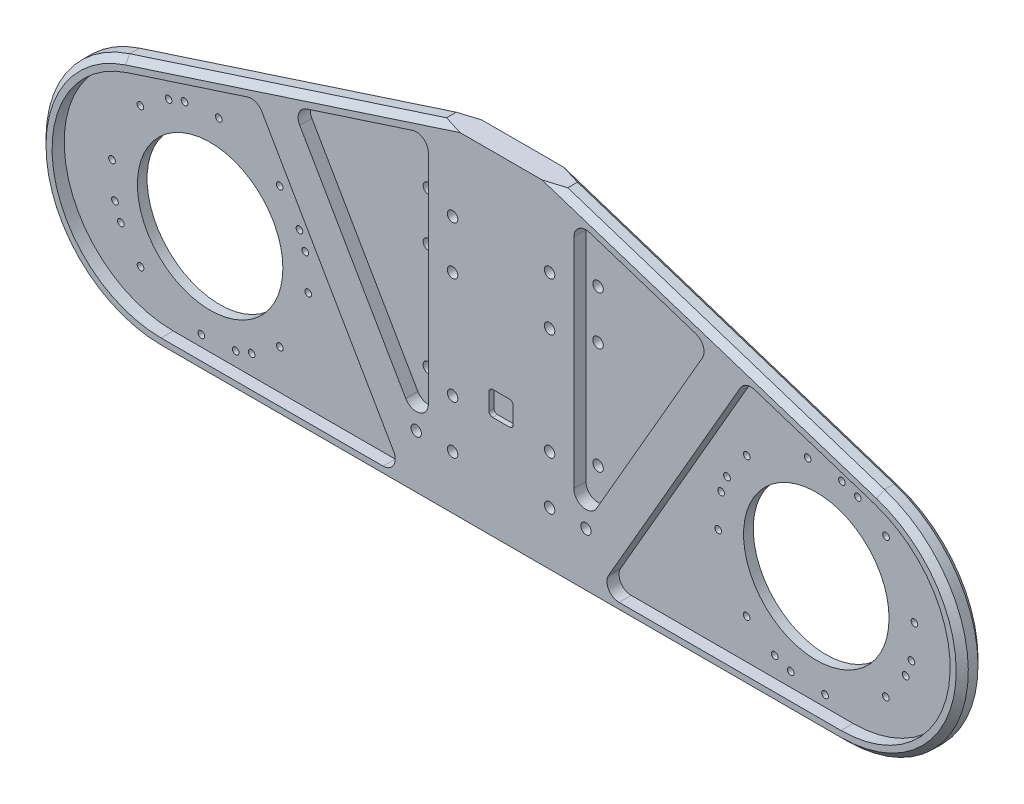
from build123d import *

# Parameters (mm, degrees)
SKETCH_1_R               = 60
EXTRUDE_1_DEPTH          = 8
FILLET_1_R               = 100
EXTRUDE_START            = 10
EXTRUDE_2_DEPTH          = 10
FILLET_2_R               = 10
CHAMFER_1_SIZE           = 5
CUT_EXTRUDE_1_DEPTH      = 514.758413114
CUT_EXTRUDE_1_DEPTH_BACK = 514.758413114
SKETCH_3_R               = 4.3
SKETCH_4_R               = 2.75
CUT_EXTRUDE_2_DEPTH      = 10
SKETCH_5_R               = 6
CUT_EXTRUDE_3_DEPTH      = 4
SKETCH_6_W               = 20
SKETCH_6_H               = 20
CUT_EXTRUDE_4_DEPTH      = 4
FILLET_3_R               = 3


with BuildPart() as part:
    # 草图1 → 凸台-拉伸1 (new body)
    with BuildSketch(Plane.XY):
        Polygon((0, 0), (-100, 0), (-961.751390409, 0), (-100, 280), (0, 280), (861.751390409, 0), align=None)
        with Locations((200, 100)):
            Circle(SKETCH_1_R, mode=Mode.SUBTRACT)
        with Locations((-300, 100)):
            Circle(SKETCH_1_R, mode=Mode.SUBTRACT)
    extrude(amount=EXTRUDE_1_DEPTH)

    # 圆角1
    fillet_1_edges = [part.edges().sort_by_distance(p)[0] for p in [
        (-961.751390409, 0, 4),
        (861.751390409, 0, 4),
    ]]
    fillet(fillet_1_edges, radius=FILLET_1_R)

    # 草图2 → 凸台-拉伸2 (add)
    # profile 1 of 2: a face of its own
    with BuildSketch(Plane.XY.offset(8).offset(EXTRUDE_START)):
        with BuildLine():
            Line((-50, 0), (-50, 280))
            Line((-50, 280), (-100, 280))
            Line((-100, 280), (-361.277938379, 195.10565163))
            ThreePointArc((-361.277938379, 195.10565163), (-429.145073001, 84.356553496), (-330.376238942, 0))
            Line((-330.376238942, 0), (-50, 0))
        make_face()
        with BuildLine():
            Line((-358.187768435, 185.595086467), (-251.410485182, 220.289128906))
            Line((-251.410485182, 220.289128906), (-130, 10))
            Line((-130, 10), (-330.376238942, 10))
            ThreePointArc((-330.376238942, 10), (-419.268189595, 85.920898146), (-358.187768435, 185.595086467))
        make_face(mode=Mode.SUBTRACT)
        Polygon((-110, 266.236180795), (-110, 35.358983849), (-222.241374643, 229.766747442), align=None, mode=Mode.SUBTRACT)
    # profile 2 of 2: a face of its own
    with BuildSketch(Plane.XY.offset(8).offset(EXTRUDE_START)):
        with BuildLine():
            Line((261.277938379, 195.10565163), (0, 280))
            Line((0, 280), (-50, 280))
            Line((-50, 280), (-50, 0))
            Line((-50, 0), (230.376238942, 0))
            ThreePointArc((230.376238942, 0), (329.145073001, 84.356553496), (261.277938379, 195.10565163))
        make_face()
        with BuildLine():
            Line((230.376238942, 10), (30, 10))
            Line((30, 10), (151.410485182, 220.289128906))
            Line((151.410485182, 220.289128906), (258.187768435, 185.595086467))
            ThreePointArc((258.187768435, 185.595086467), (319.268189595, 85.920898146), (230.376238942, 10))
        make_face(mode=Mode.SUBTRACT)
        Polygon((10, 35.358983849), (10, 266.236180795), (122.241374643, 229.766747442), align=None, mode=Mode.SUBTRACT)
    extrude(amount=-EXTRUDE_2_DEPTH)

    # 圆角2
    fillet_2_edges = [part.edges().sort_by_distance(p)[0] for p in [
        (122.241374643, 229.766747442, 13),
        (10, 35.358983849, 13),
        (30, 10, 13),
        (-130, 10, 13),
        (-222.241374643, 229.766747442, 13),
        (-110, 266.236180795, 13),
        (151.410485182, 220.289128906, 13),
        (-251.410485182, 220.289128906, 13),
        (-110, 35.358983849, 13),
        (10, 266.236180795, 13),
    ]]
    fillet(fillet_2_edges, radius=FILLET_2_R)

    # 倒角1
    chamfer_1_edges = [part.edges().sort_by_distance(p)[0] for p in [
        (130.63896919, 237.552825815, 0),
        (-50, 0, 0),
        (329.145073001, 84.356553496, 0),
        (-429.145073001, 84.356553496, 0),
        (-50, 0, 18),
        (329.145073001, 84.356553496, 18),
        (130.63896919, 237.552825815, 18),
        (-230.63896919, 237.552825815, 18),
        (-429.145073001, 84.356553496, 18),
        (-230.63896919, 237.552825815, 0),
    ]]
    chamfer(chamfer_1_edges, length=CHAMFER_1_SIZE)

    # 草图3 → 切除-拉伸1 (cut, two sides: drawn at the far end of the back side and taken through both)
    with BuildSketch(Plane(origin=(0, 0, 0), x_dir=(-1, 0, 0), z_dir=(0, 0, -1)).offset(-CUT_EXTRUDE_1_DEPTH_BACK)):
        with Locations((-20, 217)):
            Circle(SKETCH_3_R)
        with Locations((-20, 177)):
            Circle(SKETCH_3_R)
        with Locations((10, 217)):
            Circle(SKETCH_3_R)
        with Locations((10, 177)):
            Circle(SKETCH_3_R)
        with Locations((-20, 89)):
            Circle(SKETCH_3_R)
        with Locations((10, 89)):
            Circle(SKETCH_3_R)
        with Locations((-20, 49)):
            Circle(SKETCH_3_R)
        with Locations((10, 49)):
            Circle(SKETCH_3_R)
        with Locations(Location((90, 49, 0), (0, 0, 180))):
            Circle(SKETCH_3_R)
        with Locations(Location((120, 49, 0), (0, 0, 180))):
            Circle(SKETCH_3_R)
        with Locations(Location((90, 89, 0), (0, 0, 180))):
            Circle(SKETCH_3_R)
        with Locations(Location((120, 89, 0), (0, 0, 180))):
            Circle(SKETCH_3_R)
        with Locations(Location((90, 177, 0), (0, 0, 180))):
            Circle(SKETCH_3_R)
        with Locations(Location((90, 217, 0), (0, 0, 180))):
            Circle(SKETCH_3_R)
        with Locations(Location((120, 177, 0), (0, 0, 180))):
            Circle(SKETCH_3_R)
        with Locations(Location((120, 217, 0), (0, 0, 180))):
            Circle(SKETCH_3_R)
    extrude(amount=CUT_EXTRUDE_1_DEPTH + CUT_EXTRUDE_1_DEPTH_BACK, mode=Mode.SUBTRACT)

    # 草图4 → 切除-拉伸2 (cut)
    with BuildSketch(Plane.XY.offset(8)):
        with Locations((257.390001682, 42.485217492)):
            Circle(SKETCH_4_R)
        with Locations((273.674753309, 65.742253069)):
            Circle(SKETCH_4_R)
        with Locations((278.458590634, 78.885738097)):
            Circle(SKETCH_4_R)
        with Locations((280.933081449, 107.169297536)):
            Circle(SKETCH_4_R)
        with Locations((257.514782508, 157.390001682)):
            Circle(SKETCH_4_R)
        with Locations((234.257746931, 173.674753309)):
            Circle(SKETCH_4_R)
        with Locations((221.114261903, 178.458590634)):
            Circle(SKETCH_4_R)
        with Locations((192.830702464, 180.933081449)):
            Circle(SKETCH_4_R)
        with Locations((142.609998318, 157.514782508)):
            Circle(SKETCH_4_R)
        with Locations((126.325246691, 134.257746931)):
            Circle(SKETCH_4_R)
        with Locations((121.541409366, 121.114261903)):
            Circle(SKETCH_4_R)
        with Locations((119.066918551, 92.830702464)):
            Circle(SKETCH_4_R)
        with Locations((142.485217492, 42.609998318)):
            Circle(SKETCH_4_R)
        with Locations((165.742253069, 26.325246691)):
            Circle(SKETCH_4_R)
        with Locations((178.885738097, 21.541409366)):
            Circle(SKETCH_4_R)
        with Locations((-242.485217492, 42.609998318)):
            Circle(SKETCH_4_R)
        with Locations((-265.742253069, 26.325246691)):
            Circle(SKETCH_4_R)
        with Locations((-278.885738097, 21.541409366)):
            Circle(SKETCH_4_R)
        with Locations((-307.169297536, 19.066918551)):
            Circle(SKETCH_4_R)
        with Locations((-357.390001682, 42.485217492)):
            Circle(SKETCH_4_R)
        with Locations((-373.674753309, 65.742253069)):
            Circle(SKETCH_4_R)
        with Locations((-378.458590634, 78.885738097)):
            Circle(SKETCH_4_R)
        with Locations((-380.933081449, 107.169297536)):
            Circle(SKETCH_4_R)
        with Locations((-357.514782508, 157.390001682)):
            Circle(SKETCH_4_R)
        with Locations((-334.257746931, 173.674753309)):
            Circle(SKETCH_4_R)
        with Locations((-321.114261903, 178.458590634)):
            Circle(SKETCH_4_R)
        with Locations((-292.830702464, 180.933081449)):
            Circle(SKETCH_4_R)
        with Locations((-242.609998318, 157.514782508)):
            Circle(SKETCH_4_R)
        with Locations((-226.325246691, 134.257746931)):
            Circle(SKETCH_4_R)
        with Locations((-221.541409366, 121.114261903)):
            Circle(SKETCH_4_R)
        with Locations((-219.066918551, 92.830702464)):
            Circle(SKETCH_4_R)
        with Locations((207.169297536, 19.066918551)):
            Circle(SKETCH_4_R)
    extrude(amount=-CUT_EXTRUDE_2_DEPTH, mode=Mode.SUBTRACT)

    # 草图5 → 切除-拉伸3 (cut)
    with BuildSketch(Plane(origin=(0, 0, 0), x_dir=(-1, 0, 0), z_dir=(0, 0, -1))):
        with Locations((-192.830702464, 180.933081449)):
            Circle(SKETCH_5_R)
        with Locations((-142.609998318, 157.514782508)):
            Circle(SKETCH_5_R)
        with Locations((-126.325246691, 134.257746931)):
            Circle(SKETCH_5_R)
        with Locations((-121.541409366, 121.114261903)):
            Circle(SKETCH_5_R)
        with Locations((-119.066918551, 92.830702464)):
            Circle(SKETCH_5_R)
        with Locations((-142.485217492, 42.609998318)):
            Circle(SKETCH_5_R)
        with Locations((-165.742253069, 26.325246691)):
            Circle(SKETCH_5_R)
        with Locations((-178.885738097, 21.541409366)):
            Circle(SKETCH_5_R)
        with Locations((-207.169297536, 19.066918551)):
            Circle(SKETCH_5_R)
        with Locations((-257.390001682, 42.485217492)):
            Circle(SKETCH_5_R)
        with Locations((-273.674753309, 65.742253069)):
            Circle(SKETCH_5_R)
        with Locations((-278.458590634, 78.885738097)):
            Circle(SKETCH_5_R)
        with Locations((-280.933081449, 107.169297536)):
            Circle(SKETCH_5_R)
        with Locations((-257.514782508, 157.390001682)):
            Circle(SKETCH_5_R)
        with Locations((-234.257746931, 173.674753309)):
            Circle(SKETCH_5_R)
        with Locations((-221.114261903, 178.458590634)):
            Circle(SKETCH_5_R)
        with Locations(Location((321.114261903, 178.458590634, 0), (0, 0, 180))):
            Circle(SKETCH_5_R)
        with Locations(Location((334.257746931, 173.674753309, 0), (0, 0, 180))):
            Circle(SKETCH_5_R)
        with Locations(Location((357.514782508, 157.390001682, 0), (0, 0, 180))):
            Circle(SKETCH_5_R)
        with Locations(Location((380.933081449, 107.169297536, 0), (0, 0, 180))):
            Circle(SKETCH_5_R)
        with Locations(Location((378.458590634, 78.885738097, 0), (0, 0, 180))):
            Circle(SKETCH_5_R)
        with Locations(Location((373.674753309, 65.742253069, 0), (0, 0, 180))):
            Circle(SKETCH_5_R)
        with Locations(Location((357.390001682, 42.485217492, 0), (0, 0, 180))):
            Circle(SKETCH_5_R)
        with Locations(Location((307.169297536, 19.066918551, 0), (0, 0, 180))):
            Circle(SKETCH_5_R)
        with Locations(Location((278.885738097, 21.541409366, 0), (0, 0, 180))):
            Circle(SKETCH_5_R)
        with Locations(Location((265.742253069, 26.325246691, 0), (0, 0, 180))):
            Circle(SKETCH_5_R)
        with Locations(Location((242.485217492, 42.609998318, 0), (0, 0, 180))):
            Circle(SKETCH_5_R)
        with Locations(Location((219.066918551, 92.830702464, 0), (0, 0, 180))):
            Circle(SKETCH_5_R)
        with Locations(Location((221.541409366, 121.114261903, 0), (0, 0, 180))):
            Circle(SKETCH_5_R)
        with Locations(Location((226.325246691, 134.257746931, 0), (0, 0, 180))):
            Circle(SKETCH_5_R)
        with Locations(Location((242.609998318, 157.514782508, 0), (0, 0, 180))):
            Circle(SKETCH_5_R)
        with Locations(Location((292.830702464, 180.933081449, 0), (0, 0, 180))):
            Circle(SKETCH_5_R)
    extrude(amount=-CUT_EXTRUDE_3_DEPTH, mode=Mode.SUBTRACT)

    # 草图6 → 切除-拉伸4 (cut)
    with BuildSketch(Plane.XY.offset(18)):
        with Locations((-50, 100)):
            Rectangle(SKETCH_6_W, SKETCH_6_H)
    extrude(amount=-CUT_EXTRUDE_4_DEPTH, mode=Mode.SUBTRACT)

    # 圆角3
    fillet_3_edges = [part.edges().sort_by_distance(p)[0] for p in [
        (-60, 90, 16),
        (-60, 110, 16),
        (-40, 110, 16),
        (-40, 90, 16),
    ]]
    fillet(fillet_3_edges, radius=FILLET_3_R)


solid = part.part
